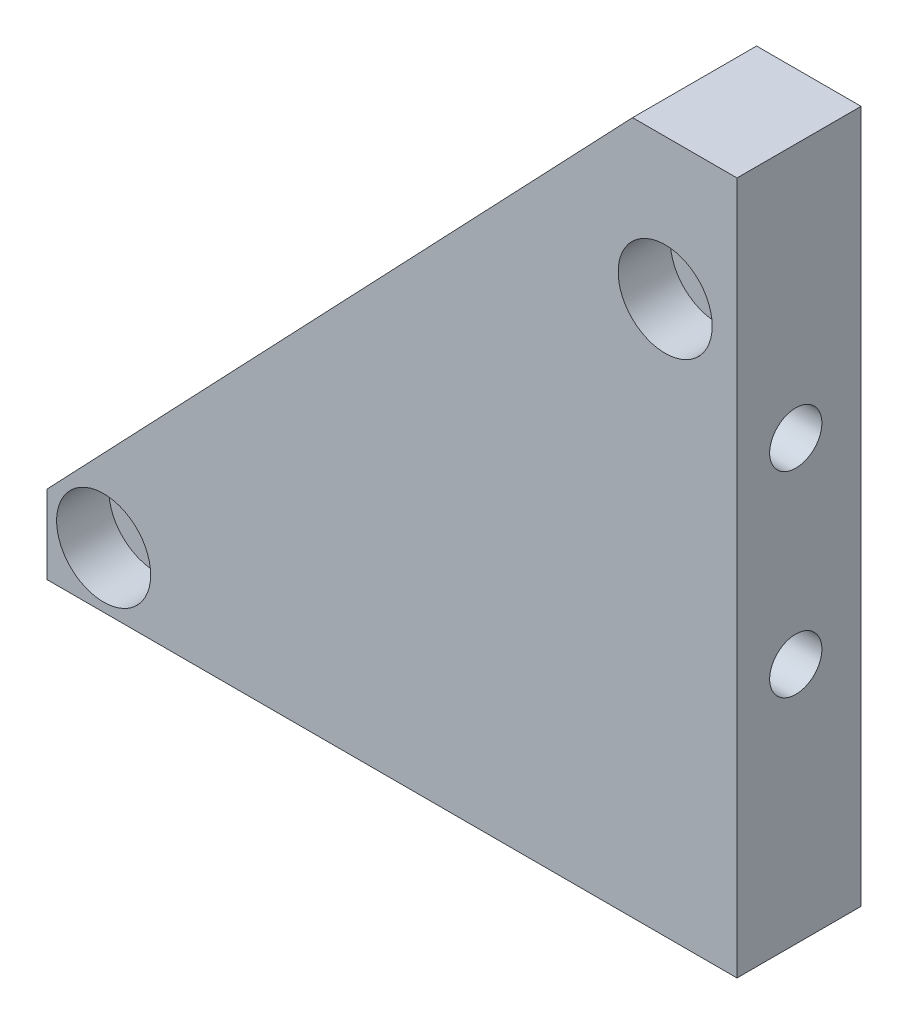
from build123d import *

# Parameters (mm, degrees)
SKETCH1_R           = 2
BOSS_EXTRUDE1_DEPTH = 9.5
SKETCH2_R           = 2
CUT_EXTRUDE1_DEPTH  = 12
SKETCH3_R           = 3.6
CUT_EXTRUDE2_DEPTH  = 4
SKETCH4_R           = 3.6
CUT_EXTRUDE3_DEPTH  = 4


with BuildPart() as part:
    # Sketch1 → Boss-Extrude1 (new body)
    with BuildSketch(Plane.XY):
        Polygon((-4.122741548, -0.104764568), (-12.122741548, -0.104764568), (-56.964364606, -47.160357663), (-56.964364606, -53.160357663), (-10.122741548, -53.160357663), (-4.122741548, -53.160357663), align=None)
        with Locations((-52.622741548, -48.884592163)):
            Circle(SKETCH1_R, mode=Mode.SUBTRACT)
        with Locations((-9.622741548, -10.884592163)):
            Circle(SKETCH1_R, mode=Mode.SUBTRACT)
    extrude(amount=BOSS_EXTRUDE1_DEPTH)

    # Sketch2 → Cut-Extrude1 (cut)
    with BuildSketch(Plane(origin=(-4.122741548, 0, 0), x_dir=(0, 0, -1), z_dir=(1, 0, 0))):
        with Locations((-5, -19.600993214)):
            Circle(SKETCH2_R)
        with Locations((-5, -34.600993214)):
            Circle(SKETCH2_R)
    extrude(amount=-CUT_EXTRUDE1_DEPTH, mode=Mode.SUBTRACT)

    # Sketch3 → Cut-Extrude2 (cut)
    with BuildSketch(Plane.XY.offset(9.5)):
        with Locations((-52.622741548, -48.884592163)):
            Circle(SKETCH3_R)
    extrude(amount=-CUT_EXTRUDE2_DEPTH, mode=Mode.SUBTRACT)

    # Sketch4 → Cut-Extrude3 (cut)
    with BuildSketch(Plane.XY.offset(9.5)):
        with Locations((-9.622741548, -10.884592163)):
            Circle(SKETCH4_R)
    extrude(amount=-CUT_EXTRUDE3_DEPTH, mode=Mode.SUBTRACT)


solid = part.part
